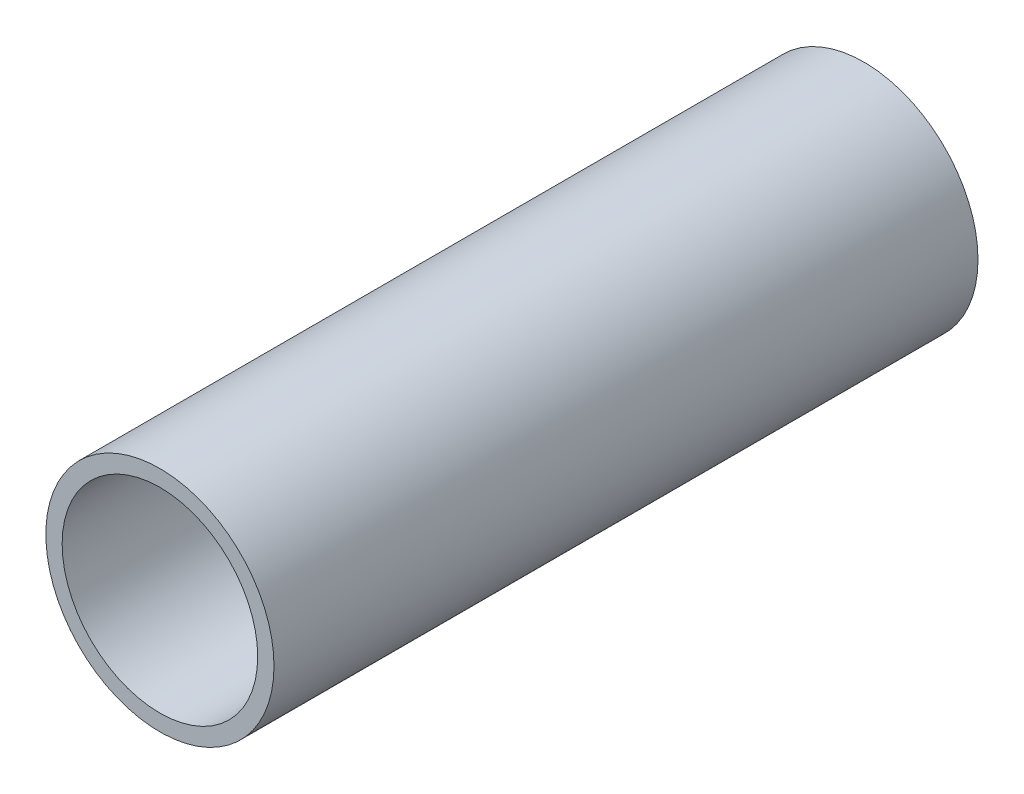
from build123d import *

# Parameters (mm, degrees)
ESQUISSE1_R          = 1.75
ESQUISSE1_R_2        = 1.5
BASE_EXTRUSION_DEPTH = 10.8


with BuildPart() as part:
    # Esquisse1 → Base-Extrusion (new body)
    with BuildSketch(Plane.XY):
        Circle(ESQUISSE1_R)
        Circle(ESQUISSE1_R_2, mode=Mode.SUBTRACT)
    extrude(amount=-BASE_EXTRUSION_DEPTH)


solid = part.part
